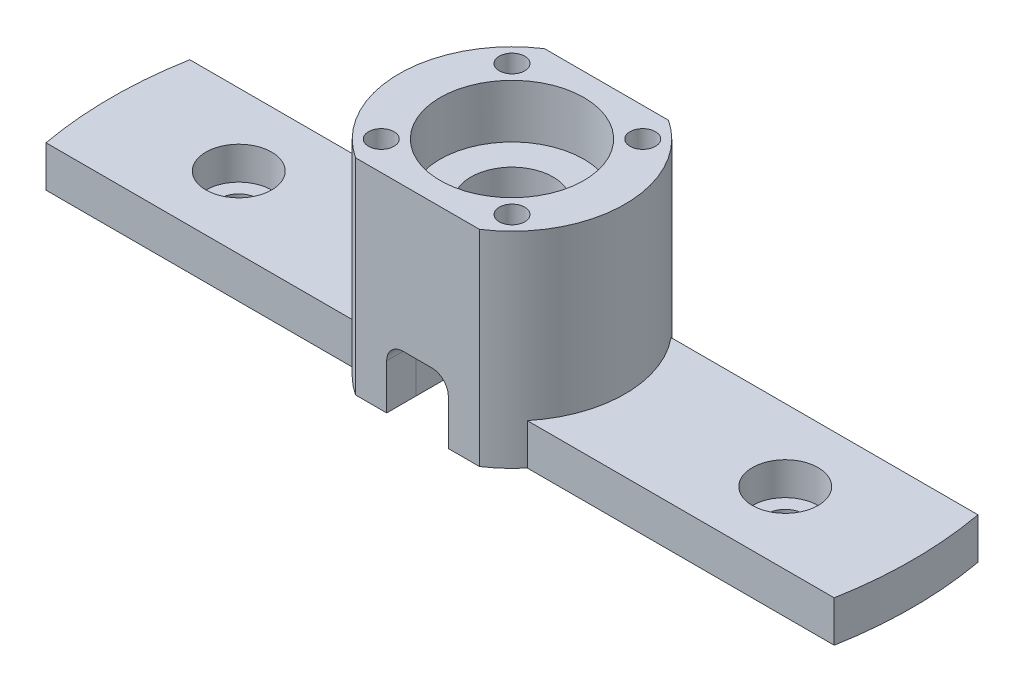
from build123d import *
from build123d.topology import SkipClean

# Parameters (mm, degrees)
SKETCH2_R                      = 8.75
SKETCH2_R_2                    = 5
BOSS_EXTRUDE1_DEPTH            = 18.5
CUT_EXTRUDE1_DEPTH             = 72.785270077
CUT_EXTRUDE1_DEPTH_BACK        = 72.785270077
CBORE_FOR_M4_SHCS1_AT_2_COUNT  = 2
CBORE_FOR_M4_SHCS1_AT_2_PITCH  = 66.5
CUT_EXTRUDE2_DEPTH             = 60.226788702
CUT_EXTRUDE2_DEPTH_BACK        = 60.226788702
SKETCH10_W                     = 7.5
SKETCH10_H                     = 7.5
FILLET2_R                      = 2
FILLET3_R                      = 2
FILLET4_R                      = 2
FILLET5_R                      = 2
FILLET6_R                      = 2
FILLET7_R                      = 2
FILLET8_R                      = 2
FILLET9_R                      = 2
F_1_0MM_DOWEL_HOLE1_AT_2_COUNT = 2
F_1_0MM_DOWEL_HOLE1_AT_2_PITCH = 15.909902577
F_1_0MM_DOWEL_HOLE1_AT_3_COUNT = 2
F_1_0MM_DOWEL_HOLE1_AT_3_PITCH = 22.5
F_1_0MM_DOWEL_HOLE1_AT_4_COUNT = 2
F_1_0MM_DOWEL_HOLE1_AT_4_PITCH = 15.909902577
CUT_EXTRUDE3_DEPTH             = 57.485617707
CUT_EXTRUDE3_DEPTH_BACK        = 57.485617707
SKETCH14_W                     = 15.074813432
SKETCH14_H                     = 4.328777268
SKETCH14_H_2                   = 4.395498361


with BuildPart() as part:
    # Sketch1 → Revolve1 (revolve)
    with BuildSketch(Plane(origin=(0, 0, 0), x_dir=(0, 0, -1), z_dir=(1, 0, 0)), mode=Mode.PRIVATE) as revolve1_sk:
        Polygon((-8.75, 0), (-48.75, 0), (-48.75, 5), (-13.75, 5), (-13.75, 25), (-8.75, 25), align=None)
    revolve(revolve1_sk.sketch.rotate(Axis((0, -1.25, 0), (0, 1, 0)), 180), axis=Axis((0, -1.25, 0), (0, 1, 0)))

    # Sketch3 → Cut-Extrude1 (cut, two sides: drawn at the far end of the back side and taken through both)
    with SkipClean():  # the faces are left unmerged after this step: merging them gives an invalid solid
        with BuildSketch(Plane(origin=(0, 5, 0), x_dir=(1, 0, 0), z_dir=(0, 1, 0)).offset(-CUT_EXTRUDE1_DEPTH_BACK)):
            with BuildLine():
                Line((-50, -8.75), (-10.606601718, -8.75))
                ThreePointArc((-10.606601718, -8.75), (0, -13.75), (10.606601718, -8.75))
                Line((10.606601718, -8.75), (50, -8.75))
                Line((50, -8.75), (50, -58.75))
                Line((50, -58.75), (-50, -58.75))
                Line((-50, -58.75), (-50, -8.75))
            make_face()
            with BuildLine():
                Line((50, 8.75), (10.606601718, 8.75))
                ThreePointArc((10.606601718, 8.75), (0, 13.75), (-10.606601718, 8.75))
                Line((-10.606601718, 8.75), (-50, 8.75))
                Line((-50, 8.75), (-50, 58.75))
                Line((-50, 58.75), (50, 58.75))
                Line((50, 58.75), (50, 8.75))
            make_face()
        extrude(amount=CUT_EXTRUDE1_DEPTH + CUT_EXTRUDE1_DEPTH_BACK, mode=Mode.SUBTRACT)

    # Sketch9 → CBORE for M4 SHCS1 (revolve, cut)
    with SkipClean():  # the faces are left unmerged after this step: merging them gives an invalid solid
        with BuildSketch(Plane(origin=(-33.25, 5, 0), x_dir=(0, 0, 1), z_dir=(1, 0, 0))):
            Polygon((0, 0), (0, 5), (2.25, 5), (2.25, 4), (4, 4), (4, 0), align=None)
        cbore_for_m4_shcs1 = revolve(axis=Axis((-33.25, 11.35, 0), (0, -1, 0)), mode=Mode.SUBTRACT)

    # CBORE for M4 SHCS1 at 2: CBORE for M4 SHCS1 ×2
    with SkipClean():  # the faces are left unmerged after this step: merging them gives an invalid solid
        with Locations(*[(i * CBORE_FOR_M4_SHCS1_AT_2_PITCH, 0, 0) for i in range(1, CBORE_FOR_M4_SHCS1_AT_2_COUNT)]):
            add(cbore_for_m4_shcs1, mode=Mode.SUBTRACT)


with BuildPart() as body_2:
    # Sketch2 → Boss-Extrude1 (new body)
    with BuildSketch(Plane.XZ):
        with Locations(Location((0, 0, 0), (0, 0, 270))):
            Circle(SKETCH2_R)
        with Locations(Location((0, 0, 0), (0, 0, 270))):
            Circle(SKETCH2_R_2, mode=Mode.SUBTRACT)
    extrude(amount=-BOSS_EXTRUDE1_DEPTH)


with BuildPart() as cut_extrude2_tool:
    # Sketch10 → Cut-Extrude2 (new, two sides: drawn at the far end of the back side and taken through both)
    with SkipClean():  # the faces are left unmerged after this step: merging them gives an invalid solid
        with BuildSketch(Plane(origin=(0, 0, -8.75), x_dir=(-1, 0, 0), z_dir=(0, 0, -1)).offset(-CUT_EXTRUDE2_DEPTH_BACK)):
            with Locations((0, 3.75)):
                Rectangle(SKETCH10_W, SKETCH10_H)
        extrude(amount=CUT_EXTRUDE2_DEPTH + CUT_EXTRUDE2_DEPTH_BACK)


with BuildPart() as part_1:
    with SkipClean():  # the faces are left unmerged after this step: merging them gives an invalid solid
        add(part.part)

        # Cut-Extrude2: cut by cut_extrude2_tool
        add(cut_extrude2_tool.part, mode=Mode.SUBTRACT)

    # Fillet2
    fillet2_edges = [part_1.edges().sort_by_distance(p)[0] for p in [
        (3.75, 7.5, 10.567225353),
    ]]
    fillet(fillet2_edges, radius=FILLET2_R)

    # Fillet3
    fillet3_edges = [part_1.edges().sort_by_distance(p)[0] for p in [
        (-3.75, 7.5, 10.567225353),
    ]]
    fillet(fillet3_edges, radius=FILLET3_R)

    # Fillet7
    fillet7_edges = [part_1.edges().sort_by_distance(p)[0] for p in [
        (-3.75, 7.5, -10.567225353),
    ]]
    fillet(fillet7_edges, radius=FILLET7_R)

    # Fillet8
    fillet8_edges = [part_1.edges().sort_by_distance(p)[0] for p in [
        (3.75, 7.5, -10.567225353),
    ]]
    fillet(fillet8_edges, radius=FILLET8_R)

    # Sketch12 → Ø1.0mm Dowel Hole1 (revolve, cut)
    with SkipClean():  # the faces are left unmerged after this step: merging them gives an invalid solid
        with BuildSketch(Plane(origin=(-7.954951288, 25, -7.954951288), x_dir=(0, 0, 1), z_dir=(1, 0, 0))):
            Polygon((0, 0), (0, 20.931333959), (1.55, 20), (1.55, 0), align=None)
        f_1_0mm_dowel_hole1 = revolve(axis=Axis((-7.954951288, 31.35, -7.954951288), (0, -1, 0)), mode=Mode.SUBTRACT)

    # Ø1.0mm Dowel Hole1 at 2: Ø1.0mm Dowel Hole1 ×2
    with SkipClean():  # the faces are left unmerged after this step: merging them gives an invalid solid
        with Locations(*[(i * F_1_0MM_DOWEL_HOLE1_AT_2_PITCH, 0, 0) for i in range(1, F_1_0MM_DOWEL_HOLE1_AT_2_COUNT)]):
            add(f_1_0mm_dowel_hole1, mode=Mode.SUBTRACT)

    # Ø1.0mm Dowel Hole1 at 3: Ø1.0mm Dowel Hole1 ×2
    with SkipClean():  # the faces are left unmerged after this step: merging them gives an invalid solid
        with Locations(*[Vector(0.707106781186549, 0, 0.7071067811865461) * (i * F_1_0MM_DOWEL_HOLE1_AT_3_PITCH) for i in range(1, F_1_0MM_DOWEL_HOLE1_AT_3_COUNT)]):
            add(f_1_0mm_dowel_hole1, mode=Mode.SUBTRACT)

    # Ø1.0mm Dowel Hole1 at 4: Ø1.0mm Dowel Hole1 ×2
    with SkipClean():  # the faces are left unmerged after this step: merging them gives an invalid solid
        with Locations(*[(0, 0, i * F_1_0MM_DOWEL_HOLE1_AT_4_PITCH) for i in range(1, F_1_0MM_DOWEL_HOLE1_AT_4_COUNT)]):
            add(f_1_0mm_dowel_hole1, mode=Mode.SUBTRACT)

    # Sketch14 → Cut-Extrude3 (cut, two sides: drawn at the far end of the back side and taken through both)
    with SkipClean():  # the faces are left unmerged after this step: merging them gives an invalid solid
        with BuildSketch(Plane(origin=(0, 25, 0), x_dir=(1, 0, 0), z_dir=(0, 1, 0)).offset(-CUT_EXTRUDE3_DEPTH_BACK)):
            with Locations((0, -13.664388634)):
                Rectangle(SKETCH14_W, SKETCH14_H)
            with Locations((0, 13.697749181)):
                Rectangle(SKETCH14_W, SKETCH14_H_2)
        extrude(amount=CUT_EXTRUDE3_DEPTH + CUT_EXTRUDE3_DEPTH_BACK, mode=Mode.SUBTRACT)


with BuildPart() as body_2_1:
    with SkipClean():  # the faces are left unmerged after this step: merging them gives an invalid solid
        add(body_2.part)

        # Cut-Extrude2: cut by cut_extrude2_tool
        add(cut_extrude2_tool.part, mode=Mode.SUBTRACT)

    # Fillet4
    fillet4_edges = [body_2_1.edges().sort_by_distance(p)[0] for p in [
        (-3.75, 7.5, 5.606441645),
    ]]
    fillet(fillet4_edges, radius=FILLET4_R)

    # Fillet5
    fillet5_edges = [body_2_1.edges().sort_by_distance(p)[0] for p in [
        (3.75, 7.5, 5.606441645),
    ]]
    fillet(fillet5_edges, radius=FILLET5_R)

    # Fillet6
    fillet6_edges = [body_2_1.edges().sort_by_distance(p)[0] for p in [
        (-3.75, 7.5, -5.606441645),
    ]]
    fillet(fillet6_edges, radius=FILLET6_R)

    # Fillet9
    fillet9_edges = [body_2_1.edges().sort_by_distance(p)[0] for p in [
        (3.75, 7.5, -5.606441645),
    ]]
    fillet(fillet9_edges, radius=FILLET9_R)


solid = Compound([part_1.part, body_2_1.part])
